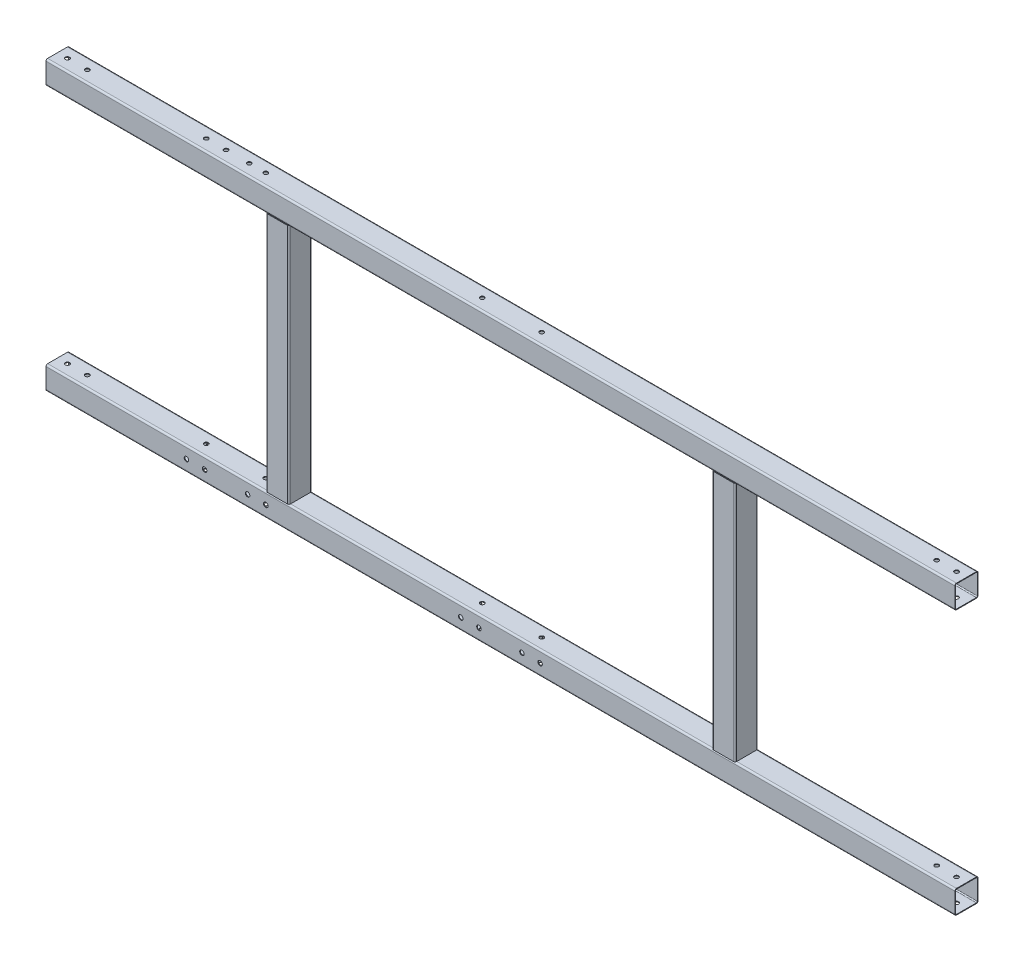
from build123d import *

# Parameters (mm, degrees)
TUBO_CUADRADO_3_X_3_X_0_25_1_DEPTH   = 2750
TUBO_CUADRADO_3_X_3_X_0_25_1_2_DEPTH = 2750
TUBO_CUADRADO_3_X_3_X_0_25_1_3_DEPTH = 802
TUBO_CUADRADO_3_X_3_X_0_25_1_4_DEPTH = 802
CROQUIS4_R                           = 6.35
CORTAR_EXTRUIR1_DEPTH                = 1628.498079876
CROQUIS5_R                           = 6.83482912
CORTAR_EXTRUIR2_DEPTH                = 1444.866337304
CROQUIS6_R                           = 6.35
CORTAR_EXTRUIR3_DEPTH                = 160


with BuildPart() as part:
    # Sketch1 → Tubo cuadrado 3 X 3 X 0.25(1) (new body)
    with BuildSketch(Plane(origin=(1375, -400, 0), x_dir=(0, -1, 0), z_dir=(-1, 0, 0))):
        with BuildLine():
            Line((-30, -35), (30, -35))
            ThreePointArc((30, -35), (33.535533906, -33.535533906), (35, -30))
            Line((35, -30), (35, 30))
            ThreePointArc((35, 30), (33.535533906, 33.535533906), (30, 35))
            Line((30, 35), (-30, 35))
            ThreePointArc((-30, 35), (-33.535533906, 33.535533906), (-35, 30))
            Line((-35, 30), (-35, -30))
            ThreePointArc((-35, -30), (-33.535533906, -33.535533906), (-30, -35))
        make_face()
        with BuildLine():
            Line((-30, -33), (30, -33))
            ThreePointArc((30, -33), (32.121320344, -32.121320344), (33, -30))
            Line((33, -30), (33, 30))
            ThreePointArc((33, 30), (32.121320344, 32.121320344), (30, 33))
            Line((30, 33), (-30, 33))
            ThreePointArc((-30, 33), (-32.121320344, 32.121320344), (-33, 30))
            Line((-33, 30), (-33, -30))
            ThreePointArc((-33, -30), (-32.121320344, -32.121320344), (-30, -33))
        make_face(mode=Mode.SUBTRACT)
    extrude(amount=TUBO_CUADRADO_3_X_3_X_0_25_1_DEPTH)


with BuildPart() as body_2:
    # Sketch1 on segment 2 (carried to segment 2) → Tubo cuadrado 3 X 3 X 0.25_1 2 (new body)
    with BuildSketch(Plane(origin=(1375, 400, 0), x_dir=(0, -1, 0), z_dir=(-1, 0, 0))):
        with BuildLine():
            Line((-30, -35), (30, -35))
            ThreePointArc((30, -35), (33.535533906, -33.535533906), (35, -30))
            Line((35, -30), (35, 30))
            ThreePointArc((35, 30), (33.535533906, 33.535533906), (30, 35))
            Line((30, 35), (-30, 35))
            ThreePointArc((-30, 35), (-33.535533906, 33.535533906), (-35, 30))
            Line((-35, 30), (-35, -30))
            ThreePointArc((-35, -30), (-33.535533906, -33.535533906), (-30, -35))
        make_face()
        with BuildLine():
            Line((-30, -33), (30, -33))
            ThreePointArc((30, -33), (32.121320344, -32.121320344), (33, -30))
            Line((33, -30), (33, 30))
            ThreePointArc((33, 30), (32.121320344, 32.121320344), (30, 33))
            Line((30, 33), (-30, 33))
            ThreePointArc((-30, 33), (-32.121320344, 32.121320344), (-33, 30))
            Line((-33, 30), (-33, -30))
            ThreePointArc((-33, -30), (-32.121320344, -32.121320344), (-30, -33))
        make_face(mode=Mode.SUBTRACT)
    extrude(amount=TUBO_CUADRADO_3_X_3_X_0_25_1_2_DEPTH)


with BuildPart() as body_3:
    # Sketch1 on segment 3 (carried to segment 3) → Tubo cuadrado 3 X 3 X 0.25_1 3 (new body)
    with BuildSketch(Plane(origin=(-675, 401, 0), x_dir=(1, 0, 0), z_dir=(0, -1, 0))):
        with BuildLine():
            Line((-30, -35), (30, -35))
            ThreePointArc((30, -35), (33.535533906, -33.535533906), (35, -30))
            Line((35, -30), (35, 30))
            ThreePointArc((35, 30), (33.535533906, 33.535533906), (30, 35))
            Line((30, 35), (-30, 35))
            ThreePointArc((-30, 35), (-33.535533906, 33.535533906), (-35, 30))
            Line((-35, 30), (-35, -30))
            ThreePointArc((-35, -30), (-33.535533906, -33.535533906), (-30, -35))
        make_face()
        with BuildLine():
            Line((-30, -33), (30, -33))
            ThreePointArc((30, -33), (32.121320344, -32.121320344), (33, -30))
            Line((33, -30), (33, 30))
            ThreePointArc((33, 30), (32.121320344, 32.121320344), (30, 33))
            Line((30, 33), (-30, 33))
            ThreePointArc((-30, 33), (-32.121320344, 32.121320344), (-33, 30))
            Line((-33, 30), (-33, -30))
            ThreePointArc((-33, -30), (-32.121320344, -32.121320344), (-30, -33))
        make_face(mode=Mode.SUBTRACT)
    extrude(amount=TUBO_CUADRADO_3_X_3_X_0_25_1_3_DEPTH)

    # Tubo cuadrado 3 X 3 X 0.25_1 3 end butt
    split(bisect_by=Plane(origin=(-675, 365, 0), x_dir=(1, 0, 0), z_dir=(0, -1, 0)), keep=Keep.TOP)

    # Tubo cuadrado 3 X 3 X 0.25_1 3 end b 2
    split(bisect_by=Plane(origin=(-675, -365, 0), x_dir=(-1, 0, 0), z_dir=(0, 1, 0)), keep=Keep.TOP)


with BuildPart() as body_4:
    # Sketch1 on segment 4 (carried to segment 4) → Tubo cuadrado 3 X 3 X 0.25_1 4 (new body)
    with BuildSketch(Plane(origin=(675, 401, 0), x_dir=(1, 0, 0), z_dir=(0, -1, 0))):
        with BuildLine():
            Line((-30, -35), (30, -35))
            ThreePointArc((30, -35), (33.535533906, -33.535533906), (35, -30))
            Line((35, -30), (35, 30))
            ThreePointArc((35, 30), (33.535533906, 33.535533906), (30, 35))
            Line((30, 35), (-30, 35))
            ThreePointArc((-30, 35), (-33.535533906, 33.535533906), (-35, 30))
            Line((-35, 30), (-35, -30))
            ThreePointArc((-35, -30), (-33.535533906, -33.535533906), (-30, -35))
        make_face()
        with BuildLine():
            Line((-30, -33), (30, -33))
            ThreePointArc((30, -33), (32.121320344, -32.121320344), (33, -30))
            Line((33, -30), (33, 30))
            ThreePointArc((33, 30), (32.121320344, 32.121320344), (30, 33))
            Line((30, 33), (-30, 33))
            ThreePointArc((-30, 33), (-32.121320344, 32.121320344), (-33, 30))
            Line((-33, 30), (-33, -30))
            ThreePointArc((-33, -30), (-32.121320344, -32.121320344), (-30, -33))
        make_face(mode=Mode.SUBTRACT)
    extrude(amount=TUBO_CUADRADO_3_X_3_X_0_25_1_4_DEPTH)

    # Tubo cuadrado 3 X 3 X 0.25_1 4 end butt
    split(bisect_by=Plane(origin=(675, 365, 0), x_dir=(1, 0, 0), z_dir=(0, -1, 0)), keep=Keep.TOP)

    # Tubo cuadrado 3 X 3 X 0.25_1 4 end b 2
    split(bisect_by=Plane(origin=(675, -365, 0), x_dir=(-1, 0, 0), z_dir=(0, 1, 0)), keep=Keep.TOP)


with BuildPart() as cortar_extruir1_tool:
    # Croquis4 → Cortar-Extruir1 (new, through all)
    with BuildSketch(Plane(origin=(0, 435, 0), x_dir=(1, 0, 0), z_dir=(0, 1, 0))):
        with Locations(Location((-1345, 0, 0), (0, 0, 180))):
            Circle(CROQUIS4_R)
        with Locations(Location((-1285, 0, 0), (0, 0, 180))):
            Circle(CROQUIS4_R)
        with Locations(Location((1285, 0, 0), (0, 0, 180))):
            Circle(CROQUIS4_R)
        with Locations(Location((1345, 0, 0), (0, 0, 180))):
            Circle(CROQUIS4_R)
        with Locations(Location((-925, 0, 0), (0, 0, 180))):
            Circle(CROQUIS4_R)
        with Locations(Location((-745, 0, 0), (0, 0, 180))):
            Circle(CROQUIS4_R)
        with Locations(Location((-90, 0, 0), (0, 0, 180))):
            Circle(CROQUIS4_R)
        with Locations(Location((90, 0, 0), (0, 0, 180))):
            Circle(CROQUIS4_R)
    extrude(amount=-CORTAR_EXTRUIR1_DEPTH)


with BuildPart() as part_1:
    add(part.part)

    # Cortar-Extruir1: cut by cortar_extruir1_tool
    add(cortar_extruir1_tool.part, mode=Mode.SUBTRACT)

    # Croquis5 → Cortar-Extruir2 (cut, through all)
    with BuildSketch(Plane(origin=(0, 0, -35), x_dir=(-1, 0, 0), z_dir=(0, 0, -1))):
        with Locations((-120, -400)):
            Circle(CROQUIS5_R)
        with Locations((-65, -400)):
            Circle(CROQUIS5_R)
        with Locations((65, -400)):
            Circle(CROQUIS5_R)
        with Locations((120, -400)):
            Circle(CROQUIS5_R)
        with Locations((710, -400)):
            Circle(CROQUIS5_R)
        with Locations((765, -400)):
            Circle(CROQUIS5_R)
        with Locations((895, -400)):
            Circle(CROQUIS5_R)
        with Locations((950, -400)):
            Circle(CROQUIS5_R)
    extrude(amount=-CORTAR_EXTRUIR2_DEPTH, mode=Mode.SUBTRACT)


with BuildPart() as body_2_1:
    add(body_2.part)

    # Cortar-Extruir1: cut by cortar_extruir1_tool
    add(cortar_extruir1_tool.part, mode=Mode.SUBTRACT)

    # Croquis6 → Cortar-Extruir3 (cut)
    with BuildSketch(Plane(origin=(0, 435, 0), x_dir=(1, 0, 0), z_dir=(0, 1, 0))):
        with Locations(Location((-865, 0, 0), (0, 0, 180))):
            Circle(CROQUIS6_R)
        with Locations(Location((-795, 0, 0), (0, 0, 180))):
            Circle(CROQUIS6_R)
    extrude(amount=-CORTAR_EXTRUIR3_DEPTH, mode=Mode.SUBTRACT)


solid = Compound([body_3.part, body_4.part, part_1.part, body_2_1.part])
